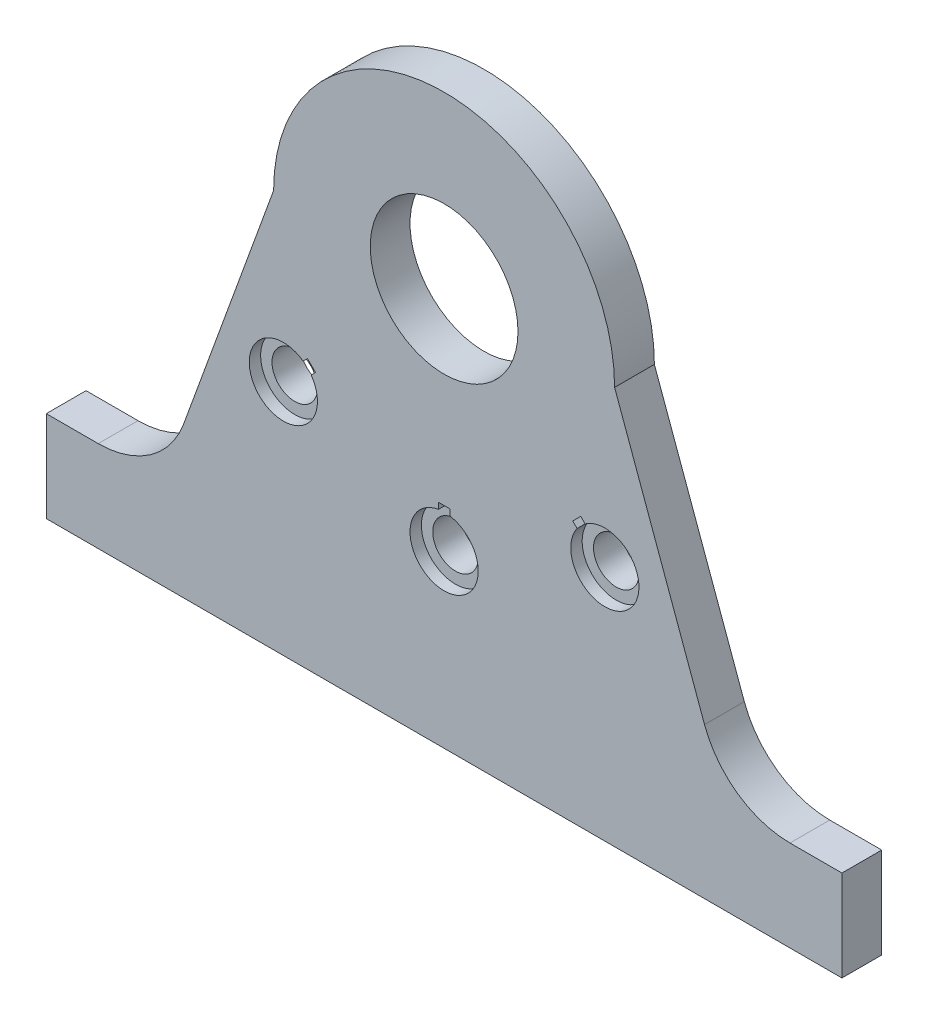
from build123d import *

# Parameters (mm, degrees)
SKETCH1_R           = 6.5
BOSS_EXTRUDE1_DEPTH = 3.5
SKETCH2_R           = 2
CUT_EXTRUDE1_DEPTH  = 10
CUT_EXTRUDE2_START  = -3.5
CUT_EXTRUDE2_DEPTH  = 1


with BuildPart() as part:
    # Sketch1 → Boss-Extrude1 (new body)
    with BuildSketch(Plane.XY):
        with BuildLine():
            Line((-15, 0), (-22.911315665, -21.736161147))
            ThreePointArc((-22.911315665, -21.736161147), (-25.84024514, -25.553216354), (-30.428856631, -27))
            Line((-30.428856631, -27), (-35, -27))
            Line((-35, -27), (-35, -35))
            Line((-35, -35), (35, -35))
            Line((35, -35), (35, -27))
            Line((35, -27), (30.428856631, -27))
            ThreePointArc((30.428856631, -27), (25.84024514, -25.553216354), (22.911315665, -21.736161147))
            Line((22.911315665, -21.736161147), (15, 0))
            ThreePointArc((15, 0), (0, 15), (-15, 0))
        make_face()
        Circle(SKETCH1_R, mode=Mode.SUBTRACT)
    extrude(amount=BOSS_EXTRUDE1_DEPTH)

    # Sketch2 → Cut-Extrude1 (cut)
    with BuildSketch(Plane.XY.offset(3.5)):
        with Locations((-14.142135624, -14.142135624)):
            Circle(SKETCH2_R)
        with Locations((0, -20)):
            Circle(SKETCH2_R)
        with Locations((14.142135624, -14.142135624)):
            Circle(SKETCH2_R)
    extrude(amount=-CUT_EXTRUDE1_DEPTH, mode=Mode.SUBTRACT)

    # Sketch3 → Cut-Extrude2 (cut)
    with BuildSketch(Plane(origin=(0, 0, 0), x_dir=(-1, 0, 0), z_dir=(0, 0, -1)).offset(CUT_EXTRUDE2_START)):
        with BuildLine():
            Line((-12.404038948, -11.696932167), (-12.02081528, -11.313708499))
            Line((-12.02081528, -11.313708499), (-11.313708499, -12.02081528))
            Line((-11.313708499, -12.02081528), (-11.696932167, -12.404038948))
            ThreePointArc((-11.696932167, -12.404038948), (-16.263455967, -16.263455967), (-12.404038948, -11.696932167))
        make_face()
        with BuildLine():
            Line((-0.5, -17.041960108), (-0.5, -16.5))
            Line((-0.5, -16.5), (0.5, -16.5))
            Line((0.5, -16.5), (0.5, -17.041960108))
            ThreePointArc((0.5, -17.041960108), (0, -23), (-0.5, -17.041960108))
        make_face()
        with BuildLine():
            Line((11.696932167, -12.404038948), (11.313708499, -12.02081528))
            Line((11.313708499, -12.02081528), (12.02081528, -11.313708499))
            Line((12.02081528, -11.313708499), (12.404038948, -11.696932167))
            ThreePointArc((12.404038948, -11.696932167), (16.263455967, -16.263455967), (11.696932167, -12.404038948))
        make_face()
    extrude(amount=CUT_EXTRUDE2_DEPTH, mode=Mode.SUBTRACT)


solid = part.part
